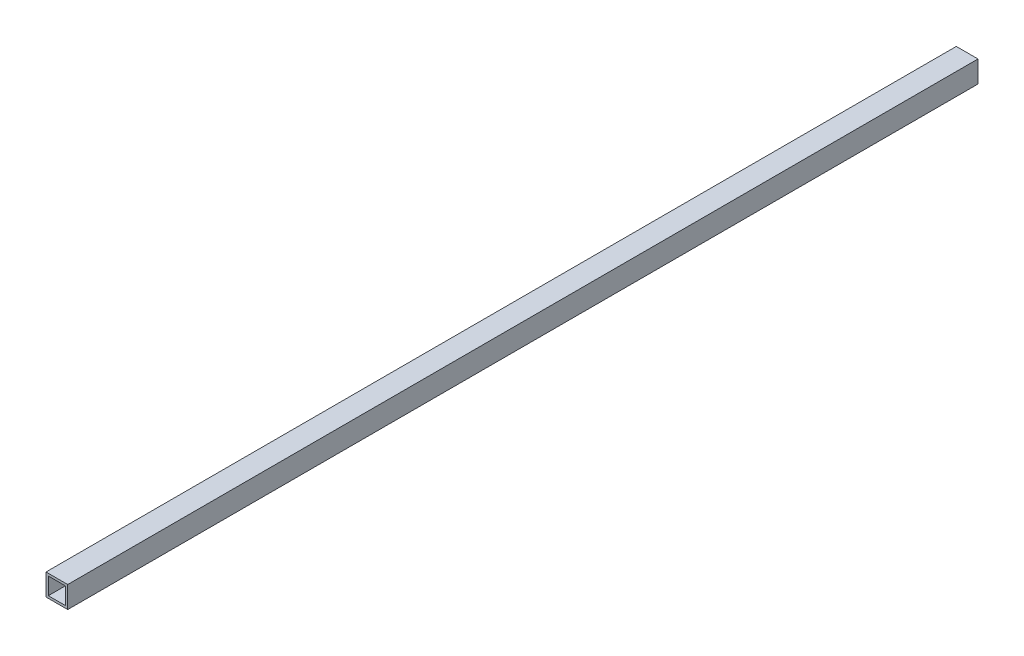
from build123d import *

# Parameters (mm, degrees)
SKETCH_1_W      = 14
SKETCH_1_H      = 14
SKETCH_1_W_2    = 11
SKETCH_1_H_2    = 11
EXTRUDE_1_DEPTH = 587


with BuildPart() as part:
    # 草图1 → 拉伸-薄壁1 (new body)
    with BuildSketch(Plane.XY):
        Rectangle(SKETCH_1_W, SKETCH_1_H)
        Rectangle(SKETCH_1_W_2, SKETCH_1_H_2, mode=Mode.SUBTRACT)
    extrude(amount=EXTRUDE_1_DEPTH)


solid = part.part
